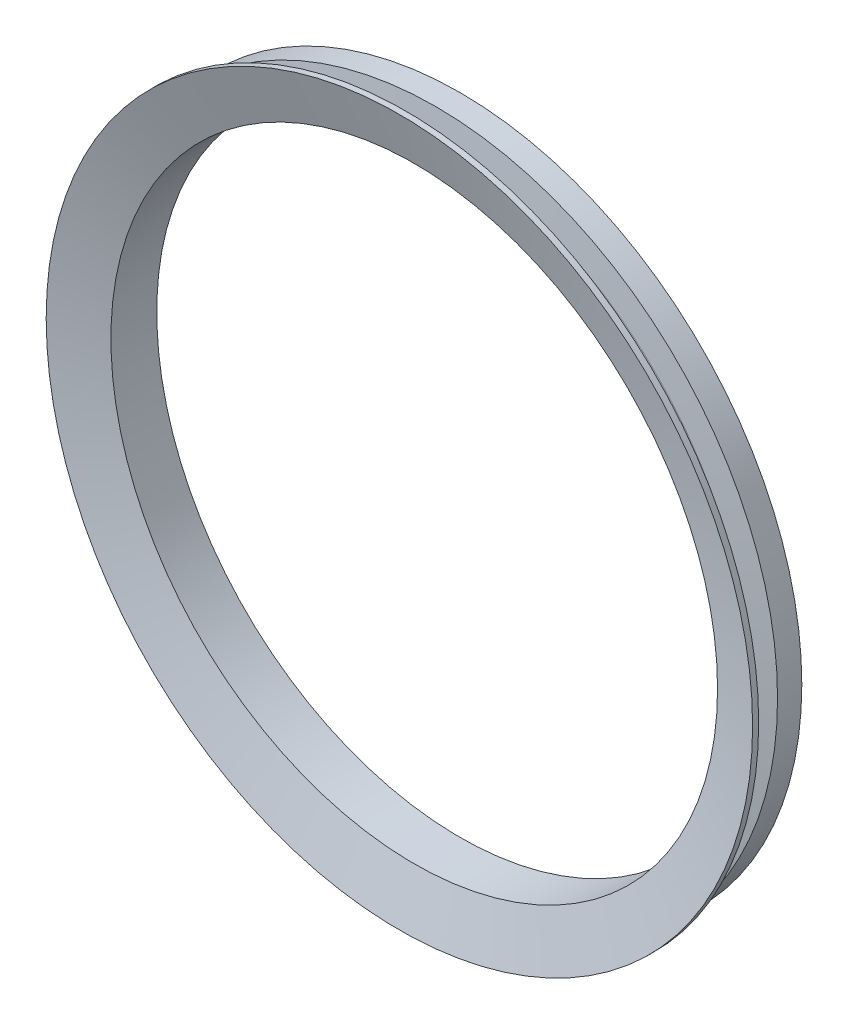
from build123d import *


with BuildPart() as part:
    # Sketch1 → Revolve1 (revolve)
    with BuildSketch(Plane(origin=(0, 0, 0), x_dir=(0, 0, -1), z_dir=(1, 0, 0)), mode=Mode.PRIVATE) as revolve1_sk:
        with BuildLine():
            Line((-9, 52.4), (-8.1, 52.4))
            Line((-8.1, 52.4), (-5.961624878, 46.638267033))
            ThreePointArc((-5.961624878, 46.638267033), (-4.902735476, 45.99360404), (-4.030378188, 46.87441611))
            Line((-4.030378188, 46.87441611), (-3.6, 50.7))
            Line((-3.6, 50.7), (0, 50.7))
            Line((0, 50.7), (0, 45))
            Line((0, 45), (-6.8, 45))
            Line((-6.8, 45), (-9, 52.4))
        make_face()
    revolve(revolve1_sk.sketch.rotate(Axis((0, 0, 0), (0, 0, -1)), 90), axis=Axis((0, 0, 0), (0, 0, -1)))


solid = part.part
